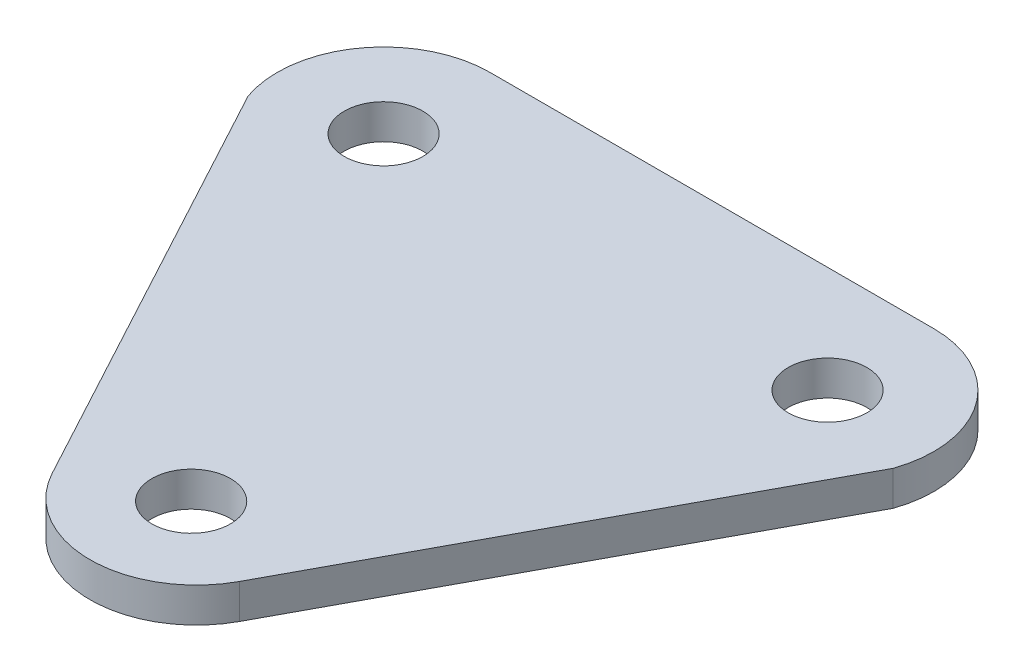
from build123d import *

# Parameters (mm, degrees)
SKETCH2_R           = 8.5
BOSS_EXTRUDE1_DEPTH = 7.5


with BuildPart() as part:
    # Sketch2 → Boss-Extrude1 (new body)
    # profile 1 of 2: a face of its own
    with BuildSketch(Plane(origin=(0, 0, 0), x_dir=(1, 0, 0), z_dir=(0, 1, 0))):
        with BuildLine():
            Line((0, 61.059418618), (-48, 61.059418618))
            ThreePointArc((-48, 61.059418618), (-66.745837136, 51.385843122), (-69.723042032, 30.502339493))
            Line((-69.723042032, 30.502339493), (-20.24936145, -61.347614016))
            ThreePointArc((-20.24936145, -61.347614016), (-11.792757299, -70.18724883), (0, -73.440581382))
            Line((0, -73.440581382), (0, -60.040453624))
            ThreePointArc((0, -60.040453624), (-8.5, -51.540453624), (0, -43.040453624))
            Line((0, -43.040453624), (0, 61.059418618))
        make_face()
        with Locations(Location((-48, 38.059418618, 0), (0, 0, 270))):
            Circle(SKETCH2_R, mode=Mode.SUBTRACT)
    # profile 2 of 2: a face of its own
    with BuildSketch(Plane(origin=(0, 0, 0), x_dir=(1, 0, 0), z_dir=(0, 1, 0))):
        with BuildLine():
            Line((48, 61.059418618), (0, 61.059418618))
            Line((0, 61.059418618), (0, -43.040453624))
            ThreePointArc((0, -43.040453624), (6.01040764, -45.530045984), (8.5, -51.540453624))
            ThreePointArc((8.5, -51.540453624), (6.01040764, -57.550861264), (0, -60.040453624))
            Line((0, -60.040453624), (0, -73.440581382))
            ThreePointArc((0, -73.440581382), (11.792757299, -70.18724883), (20.24936145, -61.347614016))
            Line((20.24936145, -61.347614016), (69.723042032, 30.502339493))
            ThreePointArc((69.723042032, 30.502339493), (66.745837136, 51.385843122), (48, 61.059418618))
        make_face()
        with Locations(Location((48, 38.059418618, 0), (0, 0, 270))):
            Circle(SKETCH2_R, mode=Mode.SUBTRACT)
    extrude(amount=BOSS_EXTRUDE1_DEPTH)


solid = part.part
